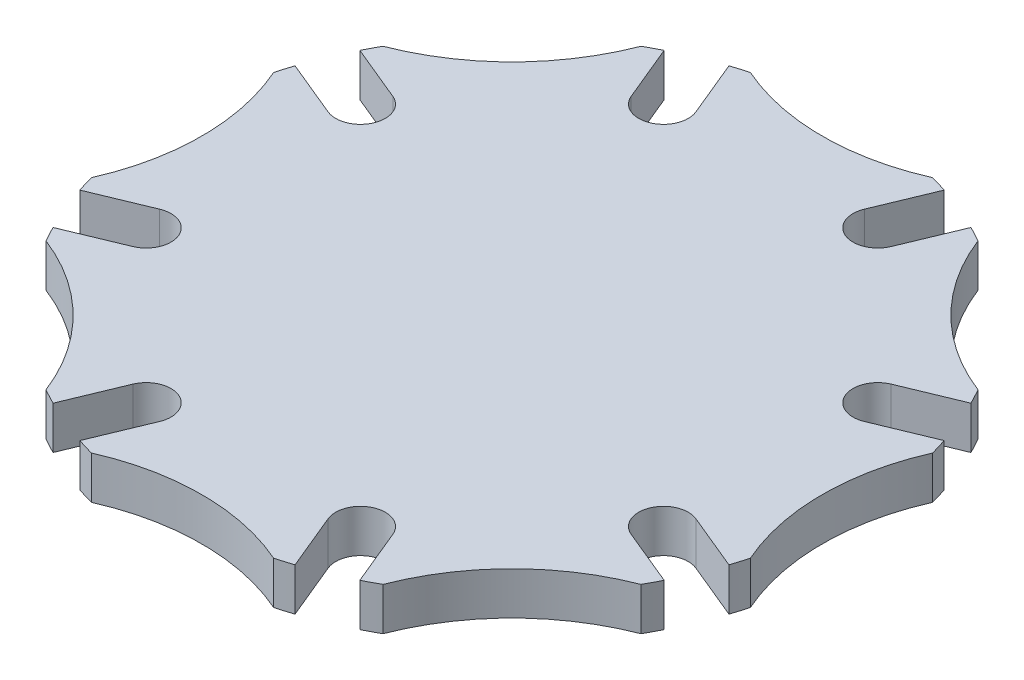
from build123d import *

# Parameters (mm, degrees)
BOSS_EXTRUDE1_DEPTH = 5


with BuildPart() as part:
    # Sketch2 → Boss-Extrude1 (new body)
    with BuildSketch(Plane(origin=(0, 0, 0), x_dir=(1, 0, 0), z_dir=(0, 1, 0))):
        with BuildLine():
            ThreePointArc((31.252747625, -9.809451481), (32.378051974, -4.96198779), (32.756061614, 0))
            ThreePointArc((32.756061614, 0), (32.378051974, 4.96198779), (31.252747625, 9.809451481))
            ThreePointArc((31.252747625, 9.809451481), (27.583404246, 11.425420135), (29.035359438, 15.162700114))
            ThreePointArc((29.035359438, 15.162700114), (23.162033292, 23.162033292), (15.162700114, 29.035359438))
            ThreePointArc((15.162700114, 29.035359438), (11.425420135, 27.583404246), (9.809451481, 31.252747625))
            ThreePointArc((9.809451481, 31.252747625), (0, 32.756061614), (-9.809451481, 31.252747625))
            ThreePointArc((-9.809451481, 31.252747625), (-11.425420135, 27.583404246), (-15.162700114, 29.035359438))
            ThreePointArc((-15.162700114, 29.035359438), (-23.162033292, 23.162033292), (-29.035359438, 15.162700114))
            ThreePointArc((-29.035359438, 15.162700114), (-27.583404246, 11.425420135), (-31.252747625, 9.809451481))
            ThreePointArc((-31.252747625, 9.809451481), (-32.756061614, 0), (-31.252747625, -9.809451481))
            ThreePointArc((-31.252747625, -9.809451481), (-27.583404246, -11.425420135), (-29.035359438, -15.162700114))
            ThreePointArc((-29.035359438, -15.162700114), (-23.162033292, -23.162033292), (-15.162700114, -29.035359438))
            ThreePointArc((-15.162700114, -29.035359438), (-11.425420135, -27.583404246), (-9.809451481, -31.252747625))
            ThreePointArc((-9.809451481, -31.252747625), (0, -32.756061614), (9.809451481, -31.252747625))
            ThreePointArc((9.809451481, -31.252747625), (11.425420135, -27.583404246), (15.162700114, -29.035359438))
            ThreePointArc((15.162700114, -29.035359438), (23.162033292, -23.162033292), (29.035359438, -15.162700114))
            ThreePointArc((29.035359438, -15.162700114), (27.583404246, -11.425420135), (31.252747625, -9.809451481))
        make_face()
        with BuildLine():
            Line((9.855951445, 31.372436845), (12.587804051, 37.967712456))
            ThreePointArc((12.587804051, 37.967712456), (11.630092201, 38.271934304), (10.665040579, 38.552002665))
            ThreePointArc((10.665040579, 38.552002665), (0, 36.306495263), (-10.665040579, 38.552002665))
            ThreePointArc((-10.665040579, 38.552002665), (-11.630092201, 38.271934304), (-12.587804051, 37.967712456))
            Line((-12.587804051, 37.967712456), (-9.855951445, 31.372436845))
            ThreePointArc((-9.855951445, 31.372436845), (-9.83203894, 31.312849629), (-9.809451481, 31.252747625))
            ThreePointArc((-9.809451481, 31.252747625), (0, 32.756061614), (9.809451481, 31.252747625))
            ThreePointArc((9.809451481, 31.252747625), (9.83203894, 31.312849629), (9.855951445, 31.372436845))
        make_face()
        with BuildLine():
            ThreePointArc((-17.946305339, 35.748148549), (-18.838627214, 35.286061337), (-19.719059997, 34.801705027))
            ThreePointArc((-19.719059997, 34.801705027), (-25.672569001, 25.672569001), (-34.801705027, 19.719059997))
            ThreePointArc((-34.801705027, 19.719059997), (-35.286061337, 18.838627214), (-35.748148549, 17.946305339))
            Line((-35.748148549, 17.946305339), (-29.152872937, 15.214452733))
            ThreePointArc((-29.152872937, 15.214452733), (-29.093829718, 15.189226904), (-29.035359438, 15.162700114))
            ThreePointArc((-29.035359438, 15.162700114), (-23.162033292, 23.162033292), (-15.162700114, 29.035359438))
            ThreePointArc((-15.162700114, 29.035359438), (-15.189226904, 29.093829718), (-15.214452733, 29.152872937))
            Line((-15.214452733, 29.152872937), (-17.946305339, 35.748148549))
        make_face()
        with BuildLine():
            ThreePointArc((-37.967712456, 12.587804051), (-38.271934304, 11.630092201), (-38.552002665, 10.665040579))
            ThreePointArc((-38.552002665, 10.665040579), (-36.873959465, 5.449435614), (-36.306495263, 0))
            ThreePointArc((-36.306495263, 0), (-36.873959465, -5.449435614), (-38.552002665, -10.665040579))
            ThreePointArc((-38.552002665, -10.665040579), (-38.271934304, -11.630092201), (-37.967712456, -12.587804051))
            Line((-37.967712456, -12.587804051), (-31.372436845, -9.855951445))
            ThreePointArc((-31.372436845, -9.855951445), (-31.312849629, -9.83203894), (-31.252747625, -9.809451481))
            ThreePointArc((-31.252747625, -9.809451481), (-32.756061614, 0), (-31.252747625, 9.809451481))
            ThreePointArc((-31.252747625, 9.809451481), (-31.312849629, 9.83203894), (-31.372436845, 9.855951445))
            Line((-31.372436845, 9.855951445), (-37.967712456, 12.587804051))
        make_face()
        with BuildLine():
            ThreePointArc((-15.214452733, -29.152872937), (-15.189226904, -29.093829718), (-15.162700114, -29.035359438))
            ThreePointArc((-15.162700114, -29.035359438), (-23.162033292, -23.162033292), (-29.035359438, -15.162700114))
            ThreePointArc((-29.035359438, -15.162700114), (-29.093829718, -15.189226904), (-29.152872937, -15.214452733))
            Line((-29.152872937, -15.214452733), (-35.748148549, -17.946305339))
            ThreePointArc((-35.748148549, -17.946305339), (-35.286061337, -18.838627214), (-34.801705027, -19.719059997))
            ThreePointArc((-34.801705027, -19.719059997), (-25.672569001, -25.672569001), (-19.719059997, -34.801705027))
            ThreePointArc((-19.719059997, -34.801705027), (-18.838627214, -35.286061337), (-17.946305339, -35.748148549))
            Line((-17.946305339, -35.748148549), (-15.214452733, -29.152872937))
        make_face()
        with BuildLine():
            ThreePointArc((9.855951445, -31.372436845), (9.83203894, -31.312849629), (9.809451481, -31.252747625))
            ThreePointArc((9.809451481, -31.252747625), (0, -32.756061614), (-9.809451481, -31.252747625))
            ThreePointArc((-9.809451481, -31.252747625), (-9.83203894, -31.312849629), (-9.855951445, -31.372436845))
            Line((-9.855951445, -31.372436845), (-12.587804051, -37.967712456))
            ThreePointArc((-12.587804051, -37.967712456), (-11.630092201, -38.271934304), (-10.665040579, -38.552002665))
            ThreePointArc((-10.665040579, -38.552002665), (0, -36.306495263), (10.665040579, -38.552002665))
            ThreePointArc((10.665040579, -38.552002665), (11.630092201, -38.271934304), (12.587804051, -37.967712456))
            Line((12.587804051, -37.967712456), (9.855951445, -31.372436845))
        make_face()
        with BuildLine():
            ThreePointArc((29.152872937, -15.214452733), (29.093829718, -15.189226904), (29.035359438, -15.162700114))
            ThreePointArc((29.035359438, -15.162700114), (23.162033292, -23.162033292), (15.162700114, -29.035359438))
            ThreePointArc((15.162700114, -29.035359438), (15.189226904, -29.093829718), (15.214452733, -29.152872937))
            Line((15.214452733, -29.152872937), (17.946305339, -35.748148549))
            ThreePointArc((17.946305339, -35.748148549), (18.838627214, -35.286061337), (19.719059997, -34.801705027))
            ThreePointArc((19.719059997, -34.801705027), (25.672569001, -25.672569001), (34.801705027, -19.719059997))
            ThreePointArc((34.801705027, -19.719059997), (35.286061337, -18.838627214), (35.748148549, -17.946305339))
            Line((35.748148549, -17.946305339), (29.152872937, -15.214452733))
        make_face()
        with BuildLine():
            ThreePointArc((34.987322012, -11.353285907), (33.319161403, -5.785231712), (32.756061614, 0))
            ThreePointArc((32.756061614, 0), (32.378051974, -4.96198779), (31.252747625, -9.809451481))
            ThreePointArc((31.252747625, -9.809451481), (31.312849629, -9.83203894), (31.372436845, -9.855951445))
            Line((31.372436845, -9.855951445), (34.987322012, -11.353285907))
        make_face()
        with BuildLine():
            ThreePointArc((38.552002665, 10.665040579), (38.271934304, 11.630092201), (37.967712456, 12.587804051))
            Line((37.967712456, 12.587804051), (34.987322012, 11.353285907))
            ThreePointArc((34.987322012, 11.353285907), (33.319161403, 5.785231712), (32.756061614, 0))
            ThreePointArc((32.756061614, 0), (33.319161403, -5.785231712), (34.987322012, -11.353285907))
            Line((34.987322012, -11.353285907), (37.967712456, -12.587804051))
            ThreePointArc((37.967712456, -12.587804051), (38.271934304, -11.630092201), (38.552002665, -10.665040579))
            ThreePointArc((38.552002665, -10.665040579), (36.306495263, 0), (38.552002665, 10.665040579))
        make_face()
        with BuildLine():
            ThreePointArc((32.756061614, 0), (33.319161403, 5.785231712), (34.987322012, 11.353285907))
            Line((34.987322012, 11.353285907), (31.372436845, 9.855951445))
            ThreePointArc((31.372436845, 9.855951445), (31.312849629, 9.83203894), (31.252747625, 9.809451481))
            ThreePointArc((31.252747625, 9.809451481), (32.378051974, 4.96198779), (32.756061614, 0))
        make_face()
        with BuildLine():
            Line((29.152872937, 15.214452733), (35.748148549, 17.946305339))
            ThreePointArc((35.748148549, 17.946305339), (35.286061337, 18.838627214), (34.801705027, 19.719059997))
            ThreePointArc((34.801705027, 19.719059997), (25.672569001, 25.672569001), (19.719059997, 34.801705027))
            ThreePointArc((19.719059997, 34.801705027), (18.838627214, 35.286061337), (17.946305339, 35.748148549))
            Line((17.946305339, 35.748148549), (15.214452733, 29.152872937))
            ThreePointArc((15.214452733, 29.152872937), (15.189226904, 29.093829718), (15.162700114, 29.035359438))
            ThreePointArc((15.162700114, 29.035359438), (23.162033292, 23.162033292), (29.035359438, 15.162700114))
            ThreePointArc((29.035359438, 15.162700114), (29.093829718, 15.189226904), (29.152872937, 15.214452733))
        make_face()
    extrude(amount=BOSS_EXTRUDE1_DEPTH)


solid = part.part
